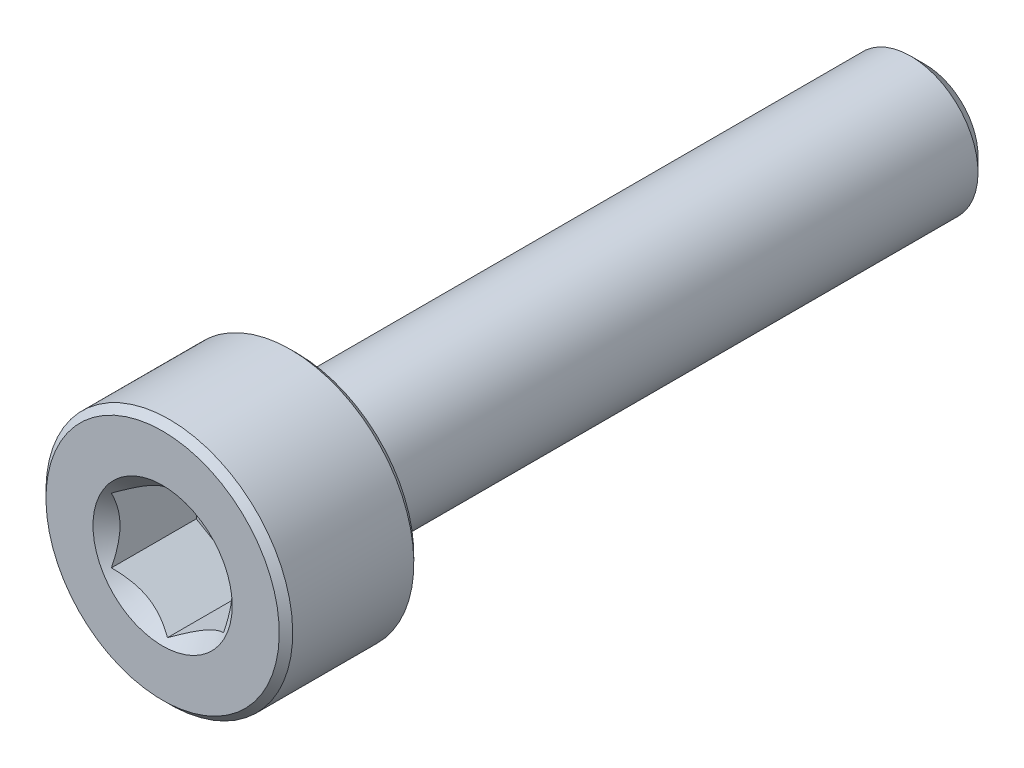
from build123d import *

# Parameters (mm, degrees)
CUT_EXTRUDE1_DEPTH = 2
SKETCH4_R          = 1.551628848
CUT_EXTRUDE2_DEPTH = 1.5
CUT_EXTRUDE2_DRAFT = -45


with BuildPart() as part:
    # Sketch2 → Revolve1 (revolve)
    with BuildSketch(Plane(origin=(0, 0, 0), x_dir=(0, 0, -1), z_dir=(1, 0, 0))):
        with BuildLine():
            Line((-8.5, 0), (-8.5, 2.6))
            Line((-8.5, 2.6), (-8.35, 2.75))
            Line((-8.35, 2.75), (-5.65, 2.75))
            Line((-5.65, 2.75), (-5.5, 2.6))
            Line((-5.5, 2.6), (-5.5, 1.65))
            ThreePointArc((-5.5, 1.65), (-5.456066017, 1.543933983), (-5.35, 1.5))
            Line((-5.35, 1.5), (8.175240474, 1.5))
            Line((8.175240474, 1.5), (8.5, 1.175240474))
            Line((8.5, 1.175240474), (8.5, 0))
            Line((8.5, 0), (-8.5, 0))
        make_face()
    revolve(axis=Axis((0, 0, -8.5), (0, 0, 1)))

    # Sketch3 → Cut-Extrude1 (cut)
    with BuildSketch(Plane.XY.offset(8.5)):
        Polygon((1.25, -0.721687836), (1.25, 0.721687836), (0, 1.443375673), (-1.25, 0.721687836), (-1.25, -0.721687836), (0, -1.443375673), align=None)
    extrude(amount=-CUT_EXTRUDE1_DEPTH, mode=Mode.SUBTRACT)


with BuildPart() as cut_extrude2_tool:
    # Sketch4 → Cut-Extrude2 (with draft: the straight prism first)
    with BuildSketch(Plane.XY.offset(8.5)):
        Circle(SKETCH4_R)
    extrude(amount=-CUT_EXTRUDE2_DEPTH)
    # Cut-Extrude2: the draft: its side faces are tilted about the plane it starts from
    cut_extrude2_sides = [cut_extrude2_tool.faces().sort_by_distance(p)[0] for p in [
        (-1.551628848, 0, 7.75),
    ]]
    draft(cut_extrude2_sides, Plane.XY.offset(8.5), CUT_EXTRUDE2_DRAFT)


with BuildPart() as part_1:
    add(part.part)

    # Cut-Extrude2: cut by cut_extrude2_tool
    add(cut_extrude2_tool.part, mode=Mode.SUBTRACT)


solid = part_1.part
